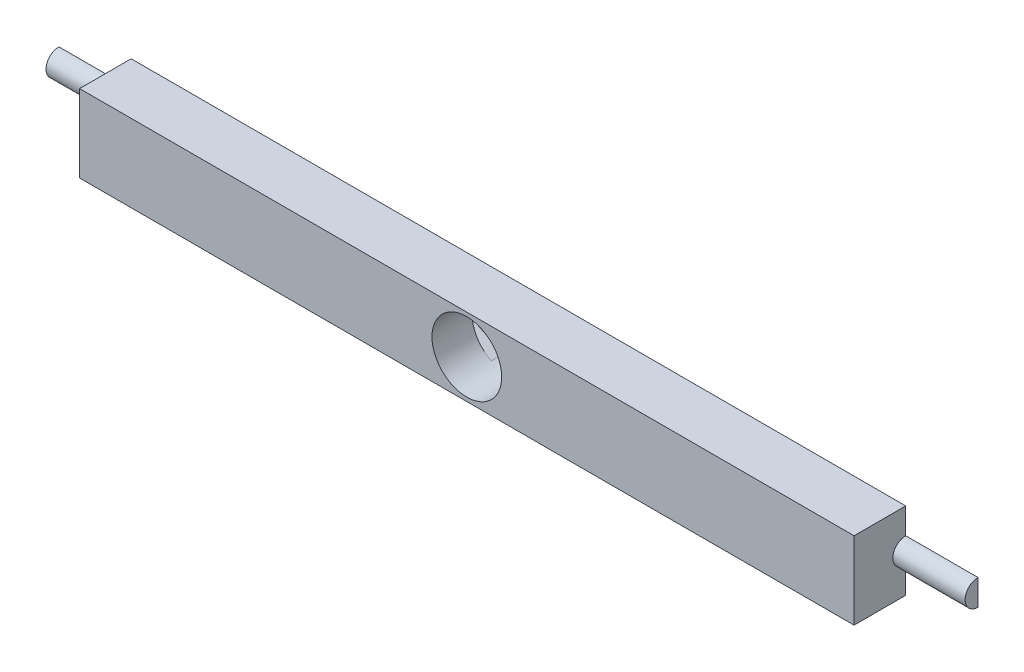
from build123d import *

# Parameters (mm, degrees)
SKETCH_1_W           = 300
SKETCH_1_H           = 30
EXTRUDE_1_DEPTH      = 20
EXTRUDE_2_DEPTH      = 28
EXTRUDE_2_DEPTH_BACK = 328
SKETCH_3_R           = 4
CUT_EXTRUDE_1_DEPTH  = 182.614977356
SKETCH_3_3_R         = 6
SKETCH_3_3_R_2       = 4
CUT_EXTRUDE_2_DEPTH  = 182.614977356
SKETCH_3_4_R         = 13.5
SKETCH_3_4_R_2       = 6
CUT_EXTRUDE_3_DEPTH  = 182.614977356
SKETCH_3_5_R         = 2.4
CUT_EXTRUDE_4_DEPTH  = 4.5
SKETCH_3_6_R         = 2.4
CUT_EXTRUDE_5_DEPTH  = 5


with BuildPart() as part:
    # 草图1 → 凸台-拉伸1 (new body)
    with BuildSketch(Plane.XY):
        with Locations((0, 15)):
            Rectangle(SKETCH_1_W, SKETCH_1_H)
    extrude(amount=EXTRUDE_1_DEPTH)

    # 草图2 → 凸台-拉伸2 (add, two sides: drawn at the far end of the back side and taken through both)
    with BuildSketch(Plane.ZY.offset(150).offset(-EXTRUDE_2_DEPTH_BACK)):
        with BuildLine():
            Line((0, 20), (0, 10))
            ThreePointArc((0, 10), (5, 15), (0, 20))
        make_face()
    extrude(amount=EXTRUDE_2_DEPTH + EXTRUDE_2_DEPTH_BACK)

    # 草图3 → 切除-拉伸1 (cut, through all)
    with BuildSketch(Plane(origin=(0, 0, 0), x_dir=(-1, 0, 0), z_dir=(0, 0, -1))):
        with Locations((0, 15)):
            Circle(SKETCH_3_R)
    extrude(amount=-CUT_EXTRUDE_1_DEPTH, mode=Mode.SUBTRACT)

    # 草图3<3> → 切除-拉伸2 (cut, through all)
    with BuildSketch(Plane(origin=(0, 0, 0), x_dir=(-1, 0, 0), z_dir=(0, 0, -1))):
        with Locations((0, 15)):
            Circle(SKETCH_3_3_R)
        with Locations((0, 15)):
            Circle(SKETCH_3_3_R_2, mode=Mode.SUBTRACT)
    extrude(amount=-CUT_EXTRUDE_2_DEPTH, mode=Mode.SUBTRACT)

    # 草图3<4> → 切除-拉伸3 (cut, through all)
    with BuildSketch(Plane(origin=(0, 0, 0), x_dir=(-1, 0, 0), z_dir=(0, 0, -1))):
        with Locations((0, 15)):
            Circle(SKETCH_3_4_R)
        with Locations((0, 15)):
            Circle(SKETCH_3_4_R_2, mode=Mode.SUBTRACT)
    extrude(amount=-CUT_EXTRUDE_3_DEPTH, mode=Mode.SUBTRACT)

    # 草图3<5> → 切除-拉伸4 (cut)
    # profile 1 of 2: a face of its own
    with BuildSketch(Plane(origin=(0, 0, 0), x_dir=(-1, 0, 0), z_dir=(0, 0, -1))):
        with BuildLine():
            ThreePointArc((-6.02027027, 2.916691435), (-13.5, 15), (-6.02027027, 27.083308565))
            Line((-6.02027027, 27.083308565), (-20.841216216, 19.699064442))
            ThreePointArc((-20.841216216, 19.699064442), (-23.75, 15), (-20.841216216, 10.300935558))
            Line((-20.841216216, 10.300935558), (-6.02027027, 2.916691435))
        make_face()
        with Locations((-18.5, 15)):
            Circle(SKETCH_3_5_R, mode=Mode.SUBTRACT)
    # profile 2 of 2: a face of its own
    with BuildSketch(Plane(origin=(0, 0, 0), x_dir=(-1, 0, 0), z_dir=(0, 0, -1))):
        with BuildLine():
            Line((20.841216216, 19.699064442), (6.02027027, 27.083308565))
            ThreePointArc((6.02027027, 27.083308565), (13.5, 15), (6.02027027, 2.916691435))
            Line((6.02027027, 2.916691435), (20.841216216, 10.300935558))
            ThreePointArc((20.841216216, 10.300935558), (23.75, 15), (20.841216216, 19.699064442))
        make_face()
        with Locations((18.5, 15)):
            Circle(SKETCH_3_5_R, mode=Mode.SUBTRACT)
    extrude(amount=-CUT_EXTRUDE_4_DEPTH, mode=Mode.SUBTRACT)

    # 草图3<6> → 切除-拉伸5 (cut)
    with BuildSketch(Plane(origin=(0, 0, 0), x_dir=(-1, 0, 0), z_dir=(0, 0, -1))):
        with Locations((18.5, 15)):
            Circle(SKETCH_3_6_R)
        with Locations((-18.5, 15)):
            Circle(SKETCH_3_6_R)
    extrude(amount=-CUT_EXTRUDE_5_DEPTH, mode=Mode.SUBTRACT)


solid = part.part
